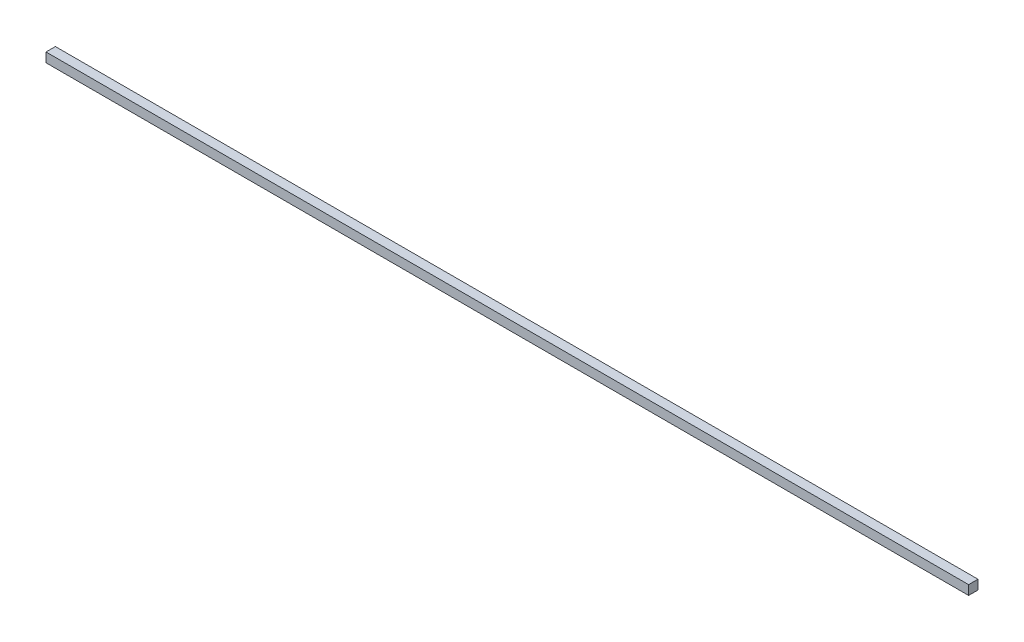
from build123d import *

# Parameters (mm, degrees)
SKETCH1_W           = 3.175
SKETCH1_H           = 3.175
BOSS_EXTRUDE1_DEPTH = 312.1


with BuildPart() as part:
    # Sketch1 → Boss-Extrude1 (new body)
    with BuildSketch(Plane(origin=(0, 0, 0), x_dir=(0, 0, -1), z_dir=(1, 0, 0))):
        Rectangle(SKETCH1_W, SKETCH1_H)
    extrude(amount=BOSS_EXTRUDE1_DEPTH)


solid = part.part
